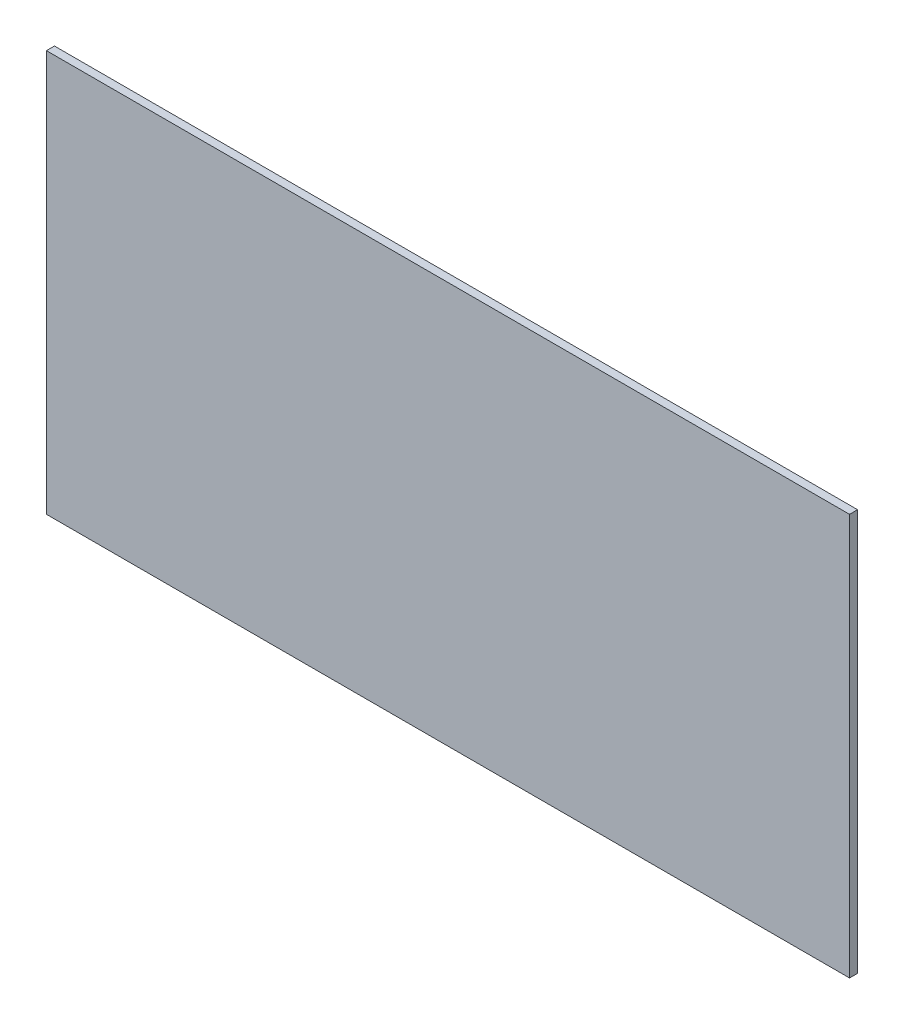
from build123d import *

# Parameters (mm, degrees)
SKETCH2_W           = 1000
SKETCH2_H           = 10
BOSS_EXTRUDE1_DEPTH = 500


with BuildPart() as part:
    # Sketch2 → Boss-Extrude1 (new body)
    with BuildSketch(Plane(origin=(0, 0, 0), x_dir=(1, 0, 0), z_dir=(0, 1, 0))):
        Rectangle(SKETCH2_W, SKETCH2_H)
    extrude(amount=BOSS_EXTRUDE1_DEPTH)


solid = part.part
